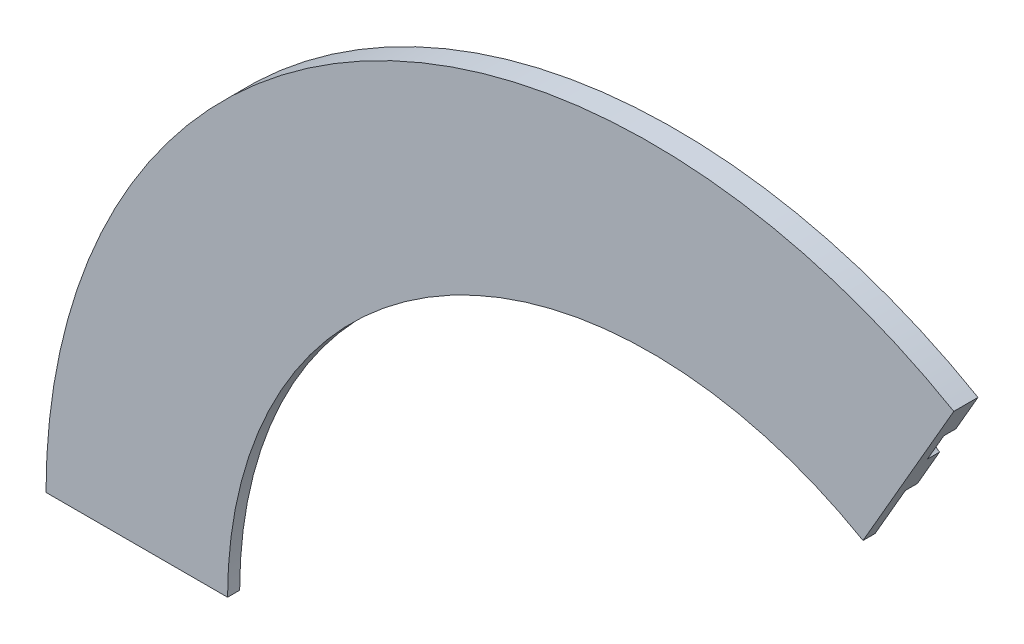
from build123d import *

# Parameters (mm, degrees)
CROQUIS1_R              = 200
CROQUIS1_R_2            = 160
CROQUIS1_R_3            = 5.4
SALIENTE_EXTRUIR1_DEPTH = 4
CROQUIS2_R              = 200
CROQUIS2_R_2            = 140
SALIENTE_EXTRUIR2_DEPTH = 4
CORTAR_EXTRUIR1_DEPTH   = 10


with BuildPart() as part:
    # Croquis1 → Saliente-Extruir1 (new body)
    with BuildSketch(Plane.XY):
        Circle(CROQUIS1_R)
        Circle(CROQUIS1_R_2, mode=Mode.SUBTRACT)
        with Locations((145.623058987, 105.801345413)):
            Circle(CROQUIS1_R_3, mode=Mode.SUBTRACT)
        with Locations((164.438182376, 73.212595754)):
            Circle(CROQUIS1_R_3, mode=Mode.SUBTRACT)
        with Locations((176.066568132, 37.424104347)):
            Circle(CROQUIS1_R_3, mode=Mode.SUBTRACT)
        with Locations((180, 0)):
            Circle(CROQUIS1_R_3, mode=Mode.SUBTRACT)
        with Locations((176.066568132, -37.424104347)):
            Circle(CROQUIS1_R_3, mode=Mode.SUBTRACT)
        with Locations((164.438182376, -73.212595754)):
            Circle(CROQUIS1_R_3, mode=Mode.SUBTRACT)
        with Locations((145.623058987, -105.801345413)):
            Circle(CROQUIS1_R_3, mode=Mode.SUBTRACT)
        with Locations((120.443509145, -133.766068586)):
            Circle(CROQUIS1_R_3, mode=Mode.SUBTRACT)
        with Locations((90, -155.884572681)):
            Circle(CROQUIS1_R_3, mode=Mode.SUBTRACT)
        with Locations((55.623058987, -171.190172933)):
            Circle(CROQUIS1_R_3, mode=Mode.SUBTRACT)
        with Locations((18.815123388, -179.013941166)):
            Circle(CROQUIS1_R_3, mode=Mode.SUBTRACT)
        with Locations((-18.815123388, -179.013941166)):
            Circle(CROQUIS1_R_3, mode=Mode.SUBTRACT)
        with Locations((-55.623058987, -171.190172933)):
            Circle(CROQUIS1_R_3, mode=Mode.SUBTRACT)
        with Locations((-90, -155.884572681)):
            Circle(CROQUIS1_R_3, mode=Mode.SUBTRACT)
        with Locations((-120.443509145, -133.766068586)):
            Circle(CROQUIS1_R_3, mode=Mode.SUBTRACT)
        with Locations((-145.623058987, -105.801345413)):
            Circle(CROQUIS1_R_3, mode=Mode.SUBTRACT)
        with Locations((-164.438182376, -73.212595754)):
            Circle(CROQUIS1_R_3, mode=Mode.SUBTRACT)
        with Locations((-176.066568132, -37.424104347)):
            Circle(CROQUIS1_R_3, mode=Mode.SUBTRACT)
        with Locations((-180, 0)):
            Circle(CROQUIS1_R_3, mode=Mode.SUBTRACT)
        with Locations((-176.066568132, 37.424104347)):
            Circle(CROQUIS1_R_3, mode=Mode.SUBTRACT)
        with Locations((-164.438182376, 73.212595754)):
            Circle(CROQUIS1_R_3, mode=Mode.SUBTRACT)
        with Locations((-145.623058987, 105.801345413)):
            Circle(CROQUIS1_R_3, mode=Mode.SUBTRACT)
        with Locations((-120.443509145, 133.766068586)):
            Circle(CROQUIS1_R_3, mode=Mode.SUBTRACT)
        with Locations((-90, 155.884572681)):
            Circle(CROQUIS1_R_3, mode=Mode.SUBTRACT)
        with Locations((-55.623058987, 171.190172933)):
            Circle(CROQUIS1_R_3, mode=Mode.SUBTRACT)
        with Locations((-18.815123388, 179.013941166)):
            Circle(CROQUIS1_R_3, mode=Mode.SUBTRACT)
        with Locations((18.815123388, 179.013941166)):
            Circle(CROQUIS1_R_3, mode=Mode.SUBTRACT)
        with Locations((55.623058987, 171.190172933)):
            Circle(CROQUIS1_R_3, mode=Mode.SUBTRACT)
        with Locations((90, 155.884572681)):
            Circle(CROQUIS1_R_3, mode=Mode.SUBTRACT)
        with Locations((120.443509145, 133.766068586)):
            Circle(CROQUIS1_R_3, mode=Mode.SUBTRACT)
    extrude(amount=SALIENTE_EXTRUIR1_DEPTH)

    # Croquis2 → Saliente-Extruir2 (add)
    with BuildSketch(Plane.XY.offset(4)):
        Circle(CROQUIS2_R)
        Circle(CROQUIS2_R_2, mode=Mode.SUBTRACT)
    extrude(amount=SALIENTE_EXTRUIR2_DEPTH)

    # Croquis3 → Cortar-Extruir1 (cut)
    with BuildSketch(Plane(origin=(0, 0, 0), x_dir=(-1, 0, 0), z_dir=(0, 0, -1))):
        Polygon((-100, 173.205080757), (-166.23575866, 173.205080757), (-252.111103181, -105.177600858), (-104.783677259, -222.566833277), (177.265619424, -205.234194933), (232.312426825, -26.788589339), (200, 0), (140, 0), (-70, 121.24355653), align=None)
    extrude(amount=-CORTAR_EXTRUIR1_DEPTH, mode=Mode.SUBTRACT)


solid = part.part
